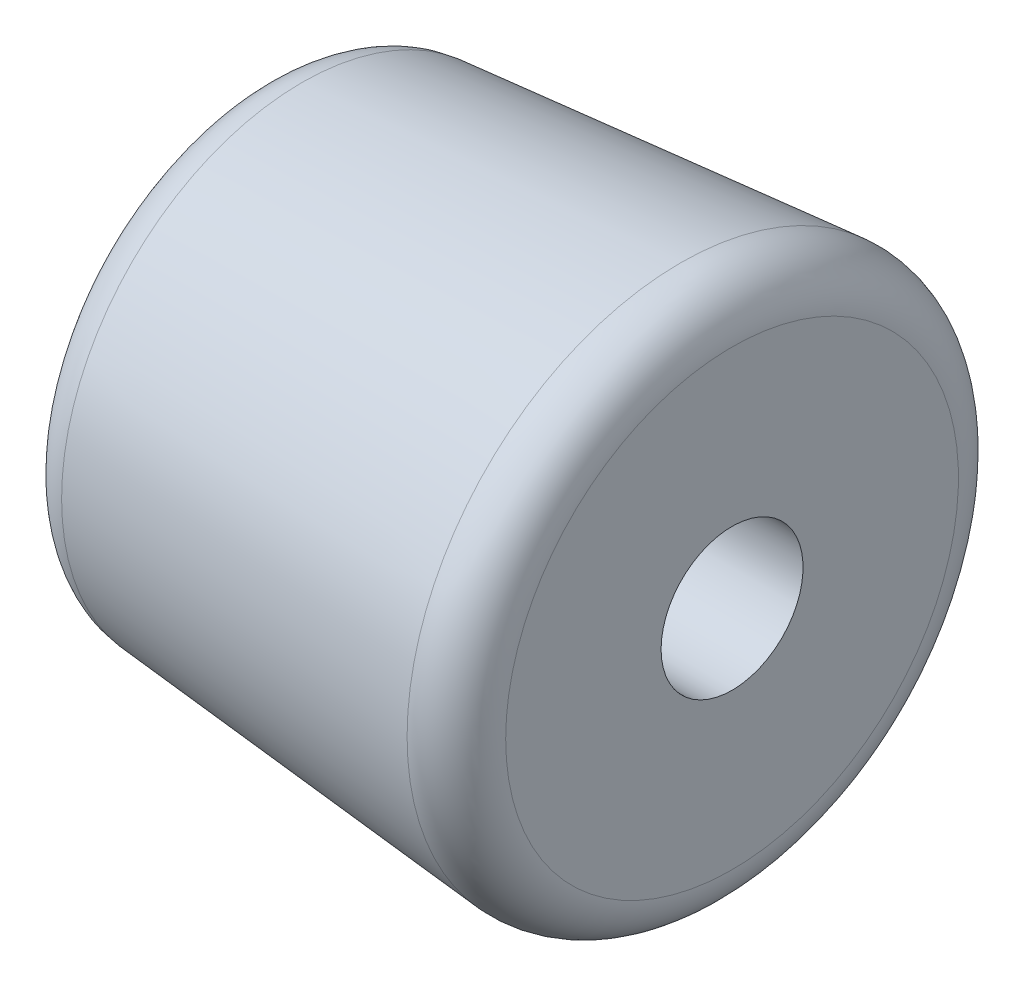
from build123d import *

# Parameters (mm, degrees)
FILETE1_R = 2


with BuildPart() as part:
    # Esboço1 → Revolução1 (revolve)
    with BuildSketch(Plane.XY, mode=Mode.PRIVATE) as revolu_o1_sk:
        Polygon((0, 3), (0, 10), (20, 11.749773271), (20, 3), align=None)
    revolve(revolu_o1_sk.sketch.rotate(Axis((0, 0, 0), (1, 0, 0)), 90), axis=Axis((0, 0, 0), (1, 0, 0)))

    # Filete1
    filete1_edges = [part.edges().sort_by_distance(p)[0] for p in [
        (20, 0, -11.749773271),
        (0, 0, -10),
    ]]
    fillet(filete1_edges, radius=FILETE1_R)


solid = part.part
